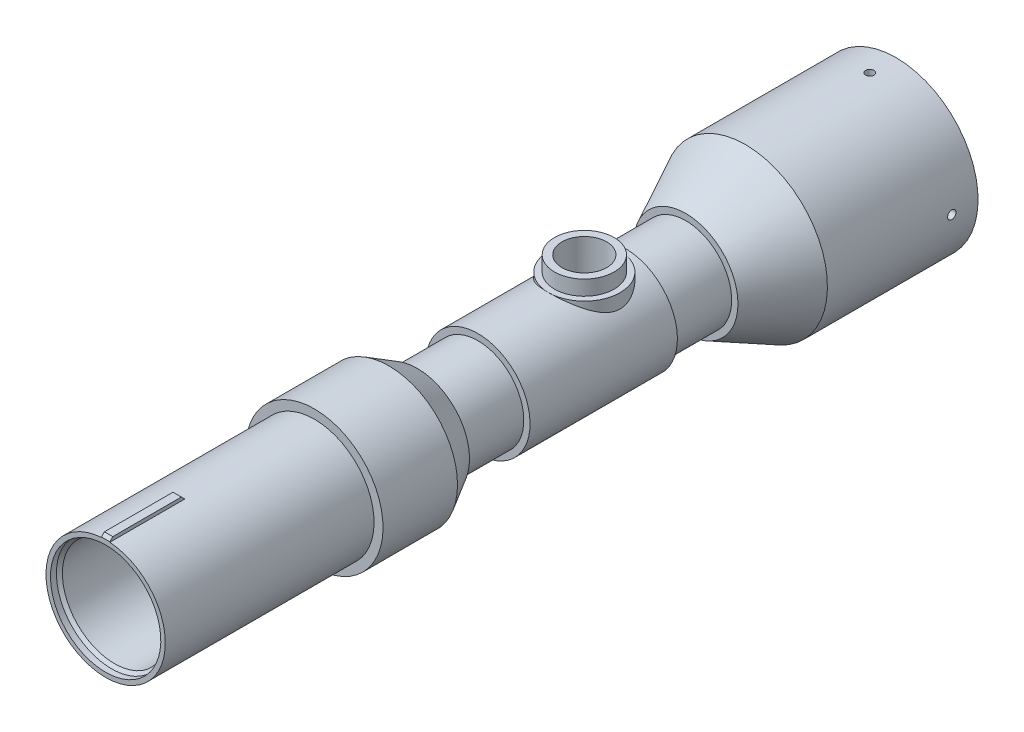
from build123d import *
from build123d.topology import SkipClean

# Parameters (mm, degrees)
SKETCH_2_R               = 7.5
CUT_EXTRUDE_1_DEPTH      = 25
SKETCH_3_R               = 10
SKETCH_3_R_2             = 7.5
EXTRUDE_1_DEPTH          = 5
SKETCH_4_W               = 20.3
SKETCH_4_H               = 2.1
SKETCH_5_R               = 12
SKETCH_5_R_2             = 10
EXTRUDE_2_DEPTH          = 5.5
CUT_EXTRUDE_2_DEPTH      = 30
SKETCH_7_W               = 2.8
SKETCH_7_H               = 2.2
EXTRUDE_3_DEPTH          = 25
CHAMFER_1_SIZE           = 1
CUT_EXTRUDE_3_DEPTH      = 268.838570785
CUT_EXTRUDE_3_DEPTH_BACK = 268.838570785
SKETCH_10_R              = 1.4
CUT_EXTRUDE_4_DEPTH      = 268.838570906
CUT_EXTRUDE_4_DEPTH_BACK = 268.838570906
SKETCH_11_R              = 1.4


with BuildPart() as part:
    # 스케치1 → 회전1 (revolve)
    with BuildSketch(Plane(origin=(0, 0, 0), x_dir=(0, 0, -1), z_dir=(1, 0, 0))):
        with BuildLine():
            Line((70, 23), (94.973720558, 23))
            Line((94.973720558, 23), (104.5, 17.5))
            Line((104.5, 17.5), (194.5, 17.5))
            Line((194.5, 17.5), (214.5, 27.5))
            Line((214.5, 27.5), (265, 27.5))
            Line((265, 27.5), (265, 25.5))
            Line((265, 25.5), (262, 25.5))
            Line((262, 25.5), (258.5, 25))
            Line((258.5, 25), (252.5, 25))
            ThreePointArc((252.5, 25), (252.204075624, 24.011481094), (252, 23))
            Line((252, 23), (248, 23))
            Line((248, 23), (243.5, 24.5))
            Line((243.5, 24.5), (214.5, 24.5))
            Line((214.5, 24.5), (194.5, 12))
            Line((194.5, 12), (138.8, 12))
            Line((138.8, 12), (136.8, 11))
            Line((136.8, 11), (133.8, 11))
            Line((133.8, 11), (133.8, 12))
            Line((133.8, 12), (109.65, 12))
            Line((109.65, 12), (109.65, 11))
            Line((109.65, 11), (106.65, 11))
            Line((106.65, 11), (91.176271489, 17.5))
            Line((91.176271489, 17.5), (3, 17.5))
            Line((3, 17.5), (2, 18.5))
            Line((2, 18.5), (0, 18.5))
            Line((0, 18.5), (0, 20))
            Line((0, 20), (70, 20))
            Line((70, 20), (70, 23))
        make_face()
    revolve(axis=Axis((0, 0, -265), (0, 0, 1)))

    # 스케치2 → 컷-돌출1 (cut, symmetric)
    with BuildSketch(Plane(origin=(0, 0, 0), x_dir=(1, 0, 0), z_dir=(0, 1, 0))):
        with Locations(Location((0, 160.5, 0), (0, 0, 90))):
            Circle(SKETCH_2_R)
    extrude(amount=CUT_EXTRUDE_1_DEPTH, both=True, mode=Mode.SUBTRACT)

    # 스케치3 → 보스-돌출1 (add, symmetric)
    with BuildSketch(Plane(origin=(0, 17.5, 0), x_dir=(1, 0, 0), z_dir=(0, 1, 0))):
        with Locations(Location((0, 160.5, 0), (0, 0, 270))):
            Circle(SKETCH_3_R)
        with Locations(Location((0, 160.5, 0), (0, 0, 90))):
            Circle(SKETCH_3_R_2, mode=Mode.SUBTRACT)
    extrude(amount=EXTRUDE_1_DEPTH, both=True)

    # 스케치4 → 컷-회전1 (revolve, cut)
    with SkipClean():  # the faces are left unmerged after this step: merging them gives an invalid solid
        with BuildSketch(Plane(origin=(0, 0, 0), x_dir=(0, 0, -1), z_dir=(1, 0, 0)), mode=Mode.PRIVATE) as cut_revolve_1_sk:
            with Locations((184.35, 16.45)):
                Rectangle(SKETCH_4_W, SKETCH_4_H)
            Polygon((80.597298362, 17.5), (104.5, 15.4), (124.8, 15.4), (124.8, 17.5), align=None)
        revolve(cut_revolve_1_sk.sketch.rotate(Axis((0, 0, -265), (0, 0, -1)), 180), axis=Axis((0, 0, -265), (0, 0, -1)), mode=Mode.SUBTRACT)


with BuildPart() as cut_revolve_1_piece_1:
    # of the separate pieces the step leaves, piece 1, a body of its own (cut_revolve_1_pieces)
    add(part.part.solids().sort_by_distance((0, 17.5, -124.8))[0])

    # 스케치5 → 보스-돌출2 (add)
    with BuildSketch(Plane(origin=(0, 17.5, 0), x_dir=(1, 0, 0), z_dir=(0, 1, 0))):
        with Locations((0, 160.5)):
            Circle(SKETCH_5_R)
        with Locations(Location((0, 160.5, 0), (0, 0, 270))):
            Circle(SKETCH_5_R_2, mode=Mode.SUBTRACT)
    extrude(amount=-EXTRUDE_2_DEPTH)

    # 스케치10 → 컷-돌출3 (cut, two sides: drawn at the far end of the back side and taken through both)
    with BuildSketch(Plane(origin=(0, 0, 0), x_dir=(0, 0, -1), z_dir=(1, 0, 0)).offset(-CUT_EXTRUDE_3_DEPTH_BACK)):
        with Locations((256.2, 0)):
            Circle(SKETCH_10_R)
    extrude(amount=CUT_EXTRUDE_3_DEPTH + CUT_EXTRUDE_3_DEPTH_BACK, mode=Mode.SUBTRACT)

    # 스케치11 → 컷-돌출4 (cut, two sides: drawn at the far end of the back side and taken through both)
    with BuildSketch(Plane(origin=(0, 0, 0), x_dir=(1, 0, 0), z_dir=(0, 1, 0)).offset(-CUT_EXTRUDE_4_DEPTH_BACK)):
        with Locations(Location((0, 256.2, 0), (0, 0, 270))):
            Circle(SKETCH_11_R)
    extrude(amount=CUT_EXTRUDE_4_DEPTH + CUT_EXTRUDE_4_DEPTH_BACK, mode=Mode.SUBTRACT)


with BuildPart() as cut_revolve_1_piece_2:
    # of the separate pieces the step leaves, piece 2, a body of its own (cut_revolve_1_pieces)
    add(part.part.solids().sort_by_distance((0, 23, -70))[0])

    # 스케치6 → 컷-돌출2 (cut)
    with SkipClean():  # the faces are left unmerged after this step: merging them gives an invalid solid
        with BuildSketch(Plane(origin=(0, 0, 0), x_dir=(1, 0, 0), z_dir=(0, 1, 0))):
            with BuildLine():
                Line((2.7, 53.666598612), (2.7, 35.300488004))
                ThreePointArc((2.7, 35.300488004), (0, 32.600488004), (-2.7, 35.300488004))
                Line((-2.7, 35.300488004), (-2.7, 53.666598612))
                ThreePointArc((-2.7, 53.666598612), (0, 56.366598612), (2.7, 53.666598612))
            make_face()
        extrude(amount=-CUT_EXTRUDE_2_DEPTH, mode=Mode.SUBTRACT)

    # 스케치7 → 보스-돌출3 (add)
    with SkipClean():  # the faces are left unmerged after this step: merging them gives an invalid solid
        with BuildSketch(Plane.XY):
            with Locations((0, 20)):
                Rectangle(SKETCH_7_W, SKETCH_7_H)
        extrude(amount=-EXTRUDE_3_DEPTH)

    # 모따기1
    chamfer_1_edges = [cut_revolve_1_piece_2.edges().sort_by_distance(p)[0] for p in [
        (0, 21.1, -25),
        (0, 21.1, 0),
    ]]
    chamfer(chamfer_1_edges, length=CHAMFER_1_SIZE)


solid = Compound([cut_revolve_1_piece_1.part, cut_revolve_1_piece_2.part])
